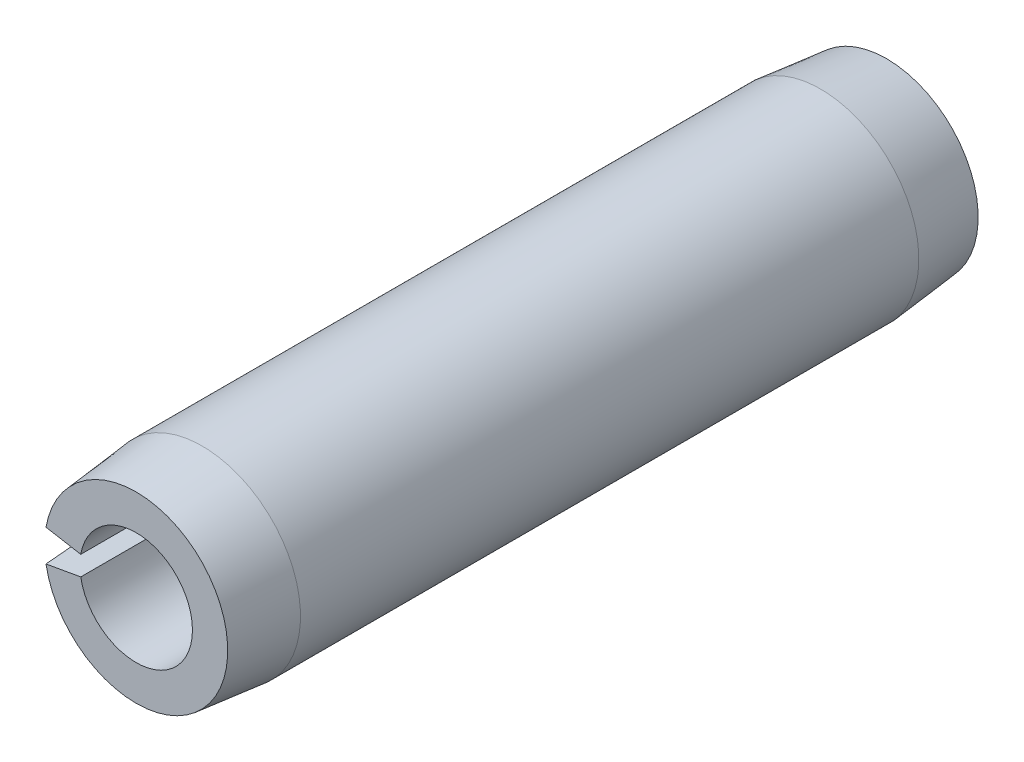
from build123d import *

# Parameters (mm, degrees)
EXTRUDE1_DEPTH = 6.35


with BuildPart() as part:
    # Sketch1 → Extrude1 (new, symmetric)
    with BuildSketch(Plane.XY):
        with BuildLine():
            Line((-1.638424659, 0.288898473), (-0.938029385, 0.165399889))
            ThreePointArc((-0.938029385, 0.165399889), (0.9525, 0), (-0.938029385, -0.165399889))
            Line((-0.938029385, -0.165399889), (-1.638424659, -0.288898473))
            ThreePointArc((-1.638424659, -0.288898473), (1.6637, 0), (-1.638424659, 0.288898473))
        make_face()
    extrude(amount=EXTRUDE1_DEPTH, both=True)

    # Sketch2 → Cut-Revolve1 (revolve, cut)
    with BuildSketch(Plane(origin=(0, 0, 0), x_dir=(0, 0, -1), z_dir=(1, 0, 0))):
        Polygon((6.35, 1.6637), (6.35, 1.5494), (5.2324, 1.6637), align=None)
        Polygon((-5.2324, 1.6637), (-6.35, 1.6637), (-6.35, 1.5494), align=None)
    revolve(axis=Axis((0, 0, -6.35), (0, 0, 1)), mode=Mode.SUBTRACT)


solid = part.part
